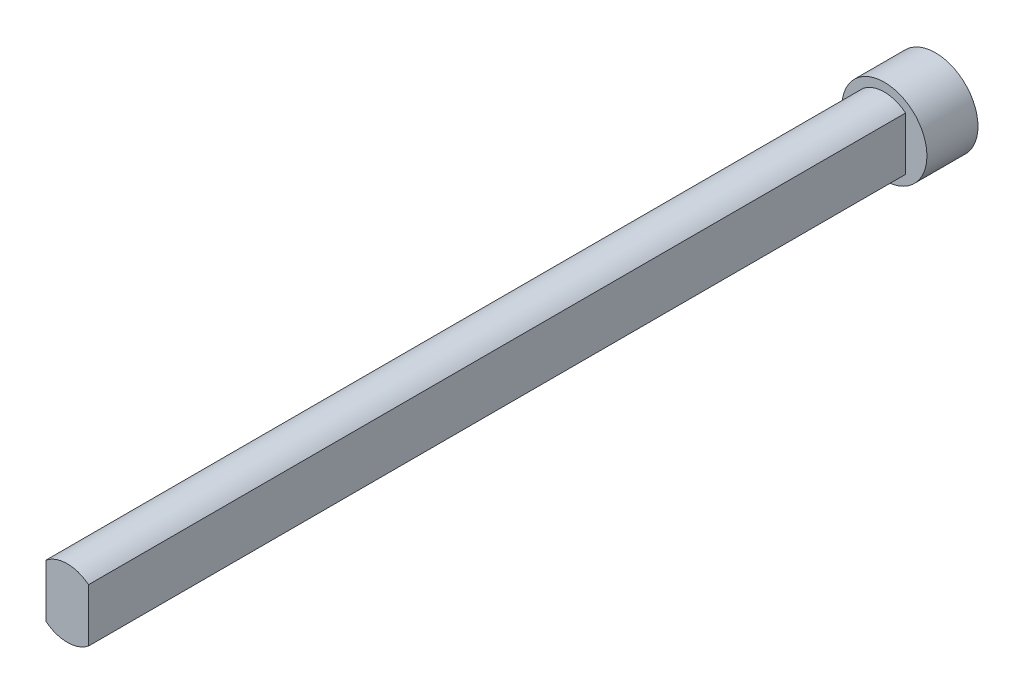
from build123d import *

# Parameters (mm, degrees)
SKETCH1_R           = 5
BOSS_EXTRUDE1_DEPTH = 6
SKETCH2_R           = 4
BOSS_EXTRUDE2_DEPTH = 96
SKETCH6_OUTSIDE_W   = 32.596
SKETCH6_OUTSIDE_H   = 32.596
SKETCH6_OUTSIDE_W_2 = 5
SKETCH6_OUTSIDE_H_2 = 16.430986644
CUT_EXTRUDE1_DEPTH  = 96


with BuildPart() as part:
    # Sketch1 → Boss-Extrude1 (new body)
    with BuildSketch(Plane.XY):
        Circle(SKETCH1_R)
    extrude(amount=BOSS_EXTRUDE1_DEPTH)

    # Sketch2 → Boss-Extrude2 (add)
    with BuildSketch(Plane.XY.offset(6)):
        Circle(SKETCH2_R)
    extrude(amount=BOSS_EXTRUDE2_DEPTH)

    # Sketch6 outside → Cut-Extrude1 (cut)
    with BuildSketch(Plane.XY.offset(102)):
        Rectangle(SKETCH6_OUTSIDE_W, SKETCH6_OUTSIDE_H)
        Rectangle(SKETCH6_OUTSIDE_W_2, SKETCH6_OUTSIDE_H_2, mode=Mode.SUBTRACT)
    extrude(amount=-CUT_EXTRUDE1_DEPTH, mode=Mode.SUBTRACT)


solid = part.part
